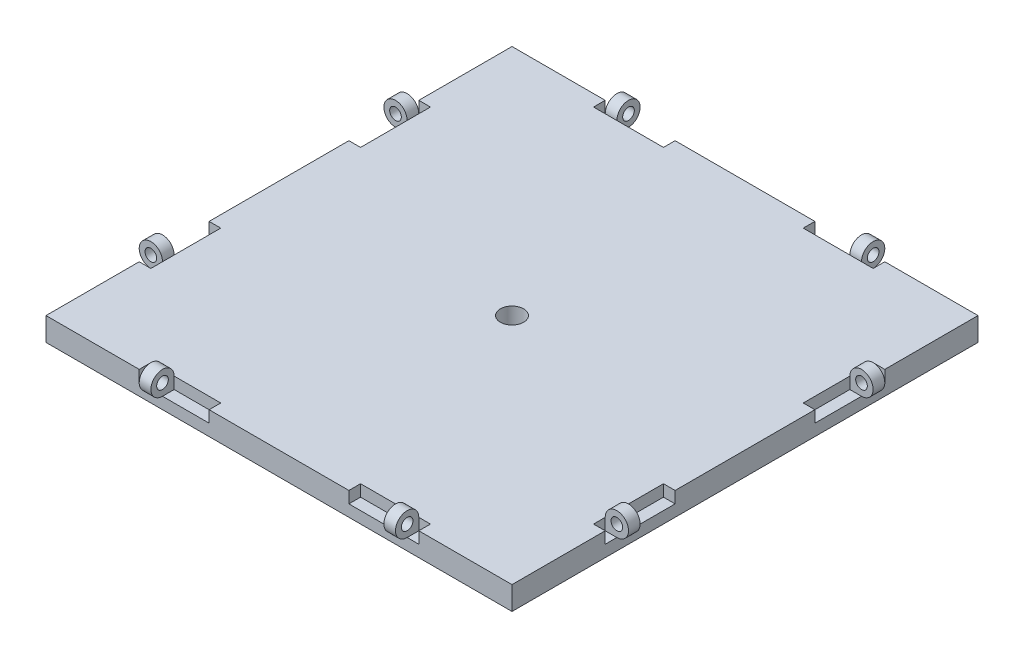
from build123d import *

# Parameters (mm, degrees)
SKETCH1_W                = 200
SKETCH1_H                = 200
SKETCH1_R                = 5
BOSS_EXTRUDE1_DEPTH      = 10
SKETCH2_W                = 30
SKETCH2_H                = 5
CUT_EXTRUDE1_DEPTH       = 5
BOSS_EXTRUDE3_START      = 5
BOSS_EXTRUDE3_DEPTH      = 5
CIRPATTERN1_COUNT        = 4
CIRPATTERN1_START        = 5
CIRPATTERN1_COPY_1_DEPTH = 5
CIRPATTERN1_COPY_2_DEPTH = 5
CIRPATTERN1_COPY_3_DEPTH = 5


with BuildPart() as part:
    # Sketch1 → Boss-Extrude1 (new body)
    with BuildSketch(Plane(origin=(0, 0, 0), x_dir=(1, 0, 0), z_dir=(0, 1, 0))):
        Rectangle(SKETCH1_W, SKETCH1_H)
        with Locations(Location((0, 0, 0), (0, 0, 270))):
            Circle(SKETCH1_R, mode=Mode.SUBTRACT)
    extrude(amount=BOSS_EXTRUDE1_DEPTH)

    # Sketch2 → Cut-Extrude1 (cut)
    with BuildSketch(Plane(origin=(0, 10, 0), x_dir=(1, 0, 0), z_dir=(0, 1, 0))):
        with Locations((45, 97.5)):
            Rectangle(SKETCH2_W, SKETCH2_H)
        with Locations((-45, 97.5)):
            Rectangle(SKETCH2_W, SKETCH2_H)
    cut_extrude1 = extrude(amount=-CUT_EXTRUDE1_DEPTH, mode=Mode.SUBTRACT)

    # Sketch3 → Boss-Extrude3 (add)
    with BuildSketch(Plane.ZY.offset(-60).offset(BOSS_EXTRUDE3_START)):
        with BuildLine():
            Line((-97.5, 10), (-95, 10))
            ThreePointArc((-95, 10), (-103.535533906, 13.535533906), (-100, 5))
            Line((-100, 5), (-100, 7.5))
            ThreePointArc((-100, 7.5), (-101.767766953, 11.767766953), (-97.5, 10))
        make_face()
        with BuildLine():
            ThreePointArc((-100, 5), (-96.464466094, 6.464466094), (-95, 10))
            Line((-95, 10), (-97.5, 10))
            ThreePointArc((-97.5, 10), (-98.232233047, 8.232233047), (-100, 7.5))
            Line((-100, 7.5), (-100, 5))
        make_face()
        with BuildLine():
            Line((-95, 5), (-95, 10))
            ThreePointArc((-95, 10), (-96.464466094, 6.464466094), (-100, 5))
            Line((-100, 5), (-95, 5))
        make_face()
    boss_extrude3 = extrude(amount=BOSS_EXTRUDE3_DEPTH)

    # Mirror1: Boss-Extrude3 across plane
    add(boss_extrude3.mirror(Plane(origin=(0, 0, 0), x_dir=(0, 0, 1), z_dir=(1, 0, 0))))

    # CirPattern1: Cut-Extrude1, Boss-Extrude3 ×4 about axis
    cirpattern1_axis = Axis((0, 0, 0), (0, 1, 0))
    add([cut_extrude1.rotate(cirpattern1_axis, i * 360 / CIRPATTERN1_COUNT) for i in range(1, CIRPATTERN1_COUNT)], mode=Mode.SUBTRACT)
    add([boss_extrude3.rotate(cirpattern1_axis, i * 360 / CIRPATTERN1_COUNT) for i in range(1, CIRPATTERN1_COUNT)])

    # CirPattern1 copy 1 sketch → CirPattern1 copy 1 (add)
    with BuildSketch(Plane(origin=(0, 0, 60), x_dir=(1, 0, 0), z_dir=(0, 0, -1)).offset(CIRPATTERN1_START)):
        with BuildLine():
            Line((-97.5, -10), (-95, -10))
            ThreePointArc((-95, -10), (-103.535533906, -13.535533906), (-100, -5))
            Line((-100, -5), (-100, -7.5))
            ThreePointArc((-100, -7.5), (-101.767766953, -11.767766953), (-97.5, -10))
        make_face()
        with BuildLine():
            ThreePointArc((-100, -5), (-96.464466094, -6.464466094), (-95, -10))
            Line((-95, -10), (-97.5, -10))
            ThreePointArc((-97.5, -10), (-98.232233047, -8.232233047), (-100, -7.5))
            Line((-100, -7.5), (-100, -5))
        make_face()
        with BuildLine():
            Line((-95, -5), (-95, -10))
            ThreePointArc((-95, -10), (-96.464466094, -6.464466094), (-100, -5))
            Line((-100, -5), (-95, -5))
        make_face()
    extrude(amount=CIRPATTERN1_COPY_1_DEPTH)

    # CirPattern1 copy 2 sketch → CirPattern1 copy 2 (add)
    with BuildSketch(Plane(origin=(60, 0, 0), x_dir=(0, 0, -1), z_dir=(-1, 0, 0)).offset(CIRPATTERN1_START)):
        with BuildLine():
            Line((-97.5, -10), (-95, -10))
            ThreePointArc((-95, -10), (-103.535533906, -13.535533906), (-100, -5))
            Line((-100, -5), (-100, -7.5))
            ThreePointArc((-100, -7.5), (-101.767766953, -11.767766953), (-97.5, -10))
        make_face()
        with BuildLine():
            ThreePointArc((-100, -5), (-96.464466094, -6.464466094), (-95, -10))
            Line((-95, -10), (-97.5, -10))
            ThreePointArc((-97.5, -10), (-98.232233047, -8.232233047), (-100, -7.5))
            Line((-100, -7.5), (-100, -5))
        make_face()
        with BuildLine():
            Line((-95, -5), (-95, -10))
            ThreePointArc((-95, -10), (-96.464466094, -6.464466094), (-100, -5))
            Line((-100, -5), (-95, -5))
        make_face()
    extrude(amount=CIRPATTERN1_COPY_2_DEPTH)

    # CirPattern1 copy 3 sketch → CirPattern1 copy 3 (add)
    with BuildSketch(Plane(origin=(0, 0, -60), x_dir=(-1, 0, 0), z_dir=(0, 0, 1)).offset(CIRPATTERN1_START)):
        with BuildLine():
            Line((-97.5, -10), (-95, -10))
            ThreePointArc((-95, -10), (-103.535533906, -13.535533906), (-100, -5))
            Line((-100, -5), (-100, -7.5))
            ThreePointArc((-100, -7.5), (-101.767766953, -11.767766953), (-97.5, -10))
        make_face()
        with BuildLine():
            ThreePointArc((-100, -5), (-96.464466094, -6.464466094), (-95, -10))
            Line((-95, -10), (-97.5, -10))
            ThreePointArc((-97.5, -10), (-98.232233047, -8.232233047), (-100, -7.5))
            Line((-100, -7.5), (-100, -5))
        make_face()
        with BuildLine():
            Line((-95, -5), (-95, -10))
            ThreePointArc((-95, -10), (-96.464466094, -6.464466094), (-100, -5))
            Line((-100, -5), (-95, -5))
        make_face()
    extrude(amount=CIRPATTERN1_COPY_3_DEPTH)


solid = part.part
